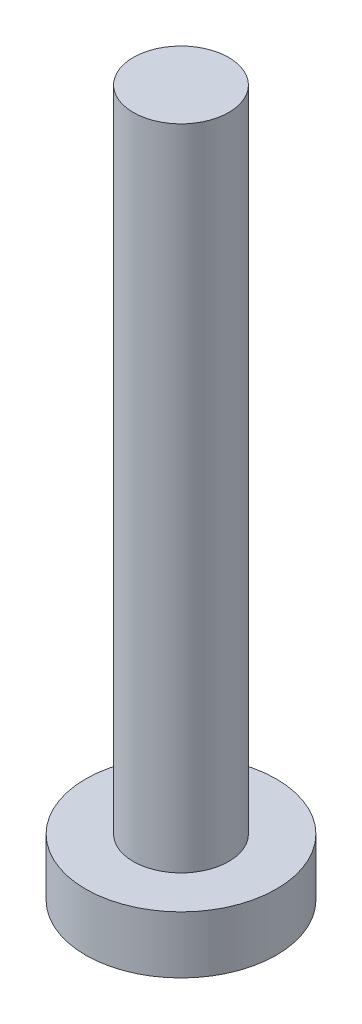
from build123d import *

# Parameters (mm, degrees)
SKETCH1_R           = 2.5
BOSS_EXTRUDE1_DEPTH = 34
SKETCH2_R           = 5
BOSS_EXTRUDE2_DEPTH = 3


with BuildPart() as part:
    # Sketch1 → Boss-Extrude1 (new body)
    with BuildSketch(Plane(origin=(0, 0, 0), x_dir=(1, 0, 0), z_dir=(0, 1, 0))):
        with Locations(Location((0, 0, 0), (0, 0, 270))):
            Circle(SKETCH1_R)
    extrude(amount=BOSS_EXTRUDE1_DEPTH)

    # Sketch2 → Boss-Extrude2 (add)
    with BuildSketch(Plane.XZ):
        with Locations(Location((0, 0, 0), (0, 0, 270))):
            Circle(SKETCH2_R)
    extrude(amount=BOSS_EXTRUDE2_DEPTH)


solid = part.part
